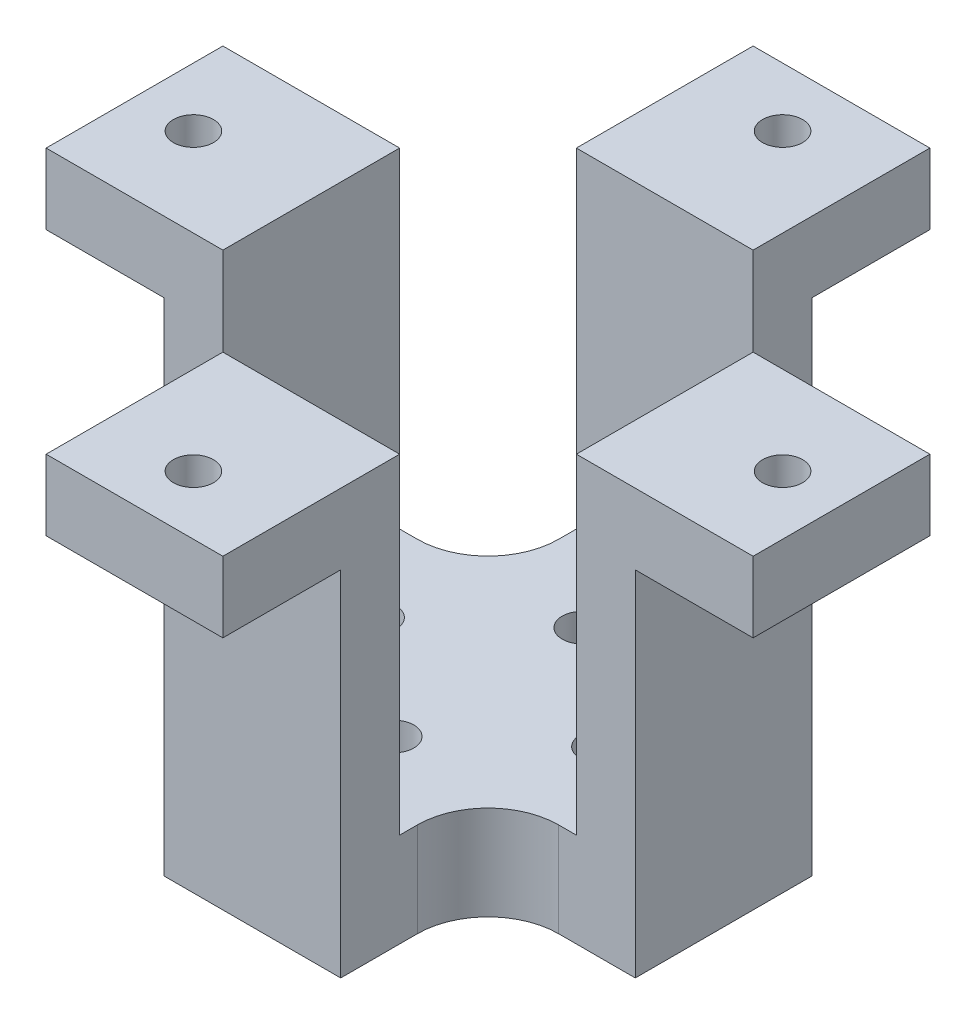
from build123d import *

# Parameters (mm, degrees)
SKETCH2_W           = 15
SKETCH2_H           = 20
BOSS_EXTRUDE1_DEPTH = 8
SKETCH3_W           = 15
SKETCH3_H           = 5
BOSS_EXTRUDE4_DEPTH = 28
SKETCH6_W           = 15
SKETCH6_H           = 10
BOSS_EXTRUDE5_DEPTH = 6
SKETCH8_R           = 1.7
CUT_EXTRUDE1_DEPTH  = 44.084219849
CIRPATTERN1_COUNT   = 4
FILLET1_R           = 6
SKETCH9_R           = 1.7
CUT_EXTRUDE2_DEPTH  = 56.641710973


with BuildPart() as part:
    # Sketch2 → Boss-Extrude1 (new body)
    with BuildSketch(Plane(origin=(0, 0, 0), x_dir=(1, 0, 0), z_dir=(0, 1, 0))):
        with Locations((0, 10)):
            Rectangle(SKETCH2_W, SKETCH2_H)
    boss_extrude1 = extrude(amount=-BOSS_EXTRUDE1_DEPTH)

    # Sketch3 → Boss-Extrude4 (add)
    with BuildSketch(Plane(origin=(0, 0, 0), x_dir=(1, 0, 0), z_dir=(0, 1, 0))):
        with Locations((0, 17.5)):
            Rectangle(SKETCH3_W, SKETCH3_H)
    boss_extrude4 = extrude(amount=BOSS_EXTRUDE4_DEPTH)

    # Sketch6 → Boss-Extrude5 (add)
    with BuildSketch(Plane(origin=(0, 28, 0), x_dir=(1, 0, 0), z_dir=(0, 1, 0))):
        with Locations((0, 25)):
            Rectangle(SKETCH6_W, SKETCH6_H)
    boss_extrude5 = extrude(amount=-BOSS_EXTRUDE5_DEPTH)

    # Sketch8 → Cut-Extrude1 (cut, through all)
    with BuildSketch(Plane.XZ.offset(-22)):
        with Locations((0, -25)):
            Circle(SKETCH8_R)
    cut_extrude1 = extrude(amount=-CUT_EXTRUDE1_DEPTH, mode=Mode.SUBTRACT)

    # CirPattern1: Boss-Extrude1, Boss-Extrude4, Boss-Extrude5, Cut-Extrude1 ×4 about axis
    cirpattern1_axis = Axis((0, -8.4, 0), (0, 1, 0))
    add([boss_extrude1.rotate(cirpattern1_axis, i * 360 / CIRPATTERN1_COUNT) for i in range(1, CIRPATTERN1_COUNT)])
    add([boss_extrude4.rotate(cirpattern1_axis, i * 360 / CIRPATTERN1_COUNT) for i in range(1, CIRPATTERN1_COUNT)])
    add([boss_extrude5.rotate(cirpattern1_axis, i * 360 / CIRPATTERN1_COUNT) for i in range(1, CIRPATTERN1_COUNT)])
    add([cut_extrude1.rotate(cirpattern1_axis, i * 360 / CIRPATTERN1_COUNT) for i in range(1, CIRPATTERN1_COUNT)], mode=Mode.SUBTRACT)

    # Fillet1
    fillet1_edges = [part.edges().sort_by_distance(p)[0] for p in [
        (7.5, -4, -7.5),
        (7.5, -4, 7.5),
        (-7.5, -4, 7.5),
        (-7.5, -4, -7.5),
    ]]
    fillet(fillet1_edges, radius=FILLET1_R)

    # Sketch9 → Cut-Extrude2 (cut, through all)
    with BuildSketch(Plane.XZ.offset(8)):
        with Locations((0, 8)):
            Circle(SKETCH9_R)
        with Locations((9.5, 0)):
            Circle(SKETCH9_R)
        with Locations((0, -8)):
            Circle(SKETCH9_R)
        with Locations((-9.5, 0)):
            Circle(SKETCH9_R)
    extrude(amount=-CUT_EXTRUDE2_DEPTH, mode=Mode.SUBTRACT)


solid = part.part
